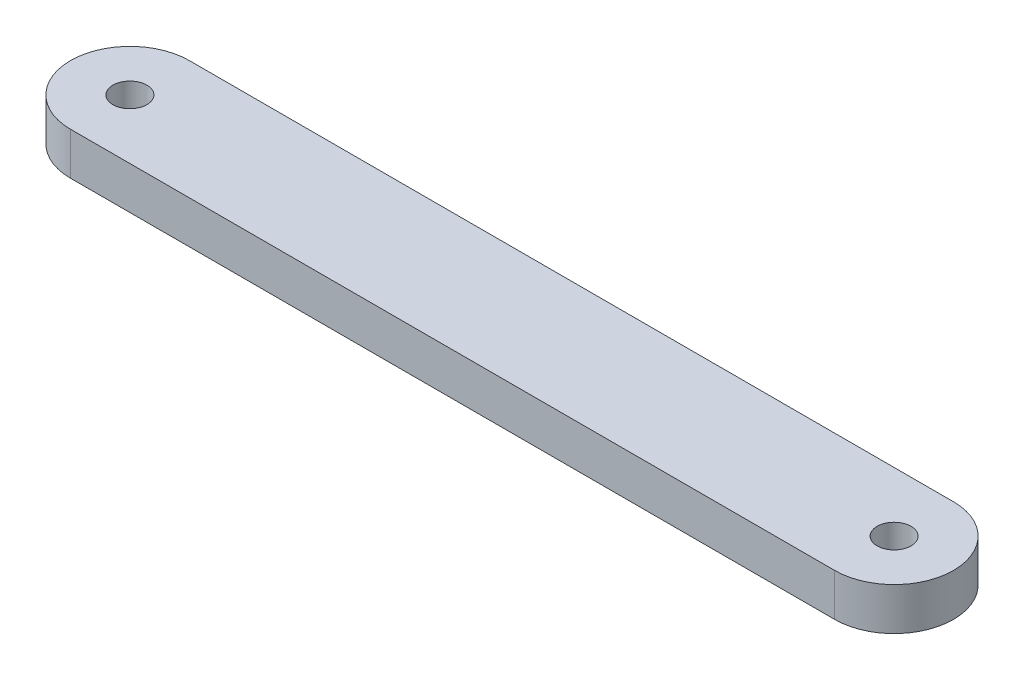
from build123d import *

# Parameters (mm, degrees)
IZIM1_R                     = 2
Y_KSEKLIK_EKSTR_ZYON1_DEPTH = 2.5
KES_EKSTR_ZYON1_START       = -2.5
IZIM2_R                     = 2
KES_EKSTR_ZYON1_DEPTH       = 2.5


with BuildPart() as part:
    # Çizim1 → Yükseklik-Ekstrüzyon1 (new, symmetric)
    with BuildSketch(Plane(origin=(0, 0, 0), x_dir=(1, 0, 0), z_dir=(0, 1, 0))):
        with BuildLine():
            Line((-45, 7), (45, 7))
            ThreePointArc((45, 7), (52, 0), (45, -7))
            Line((45, -7), (-45, -7))
            ThreePointArc((-45, -7), (-52, 0), (-45, 7))
        make_face()
        with Locations(Location((-45, 0, 0), (0, 0, 270))):
            Circle(IZIM1_R, mode=Mode.SUBTRACT)
        with Locations(Location((45, 0, 0), (0, 0, 270))):
            Circle(IZIM1_R, mode=Mode.SUBTRACT)
    extrude(amount=Y_KSEKLIK_EKSTR_ZYON1_DEPTH, both=True)

    # Çizim2 → Kes-Ekstrüzyon1 (cut)
    with BuildSketch(Plane.XZ.offset(2.5).offset(KES_EKSTR_ZYON1_START)):
        with Locations(Location((0, 0, 0), (0, 0, 270))):
            Circle(IZIM2_R)
    extrude(amount=KES_EKSTR_ZYON1_DEPTH, mode=Mode.SUBTRACT)


solid = part.part
